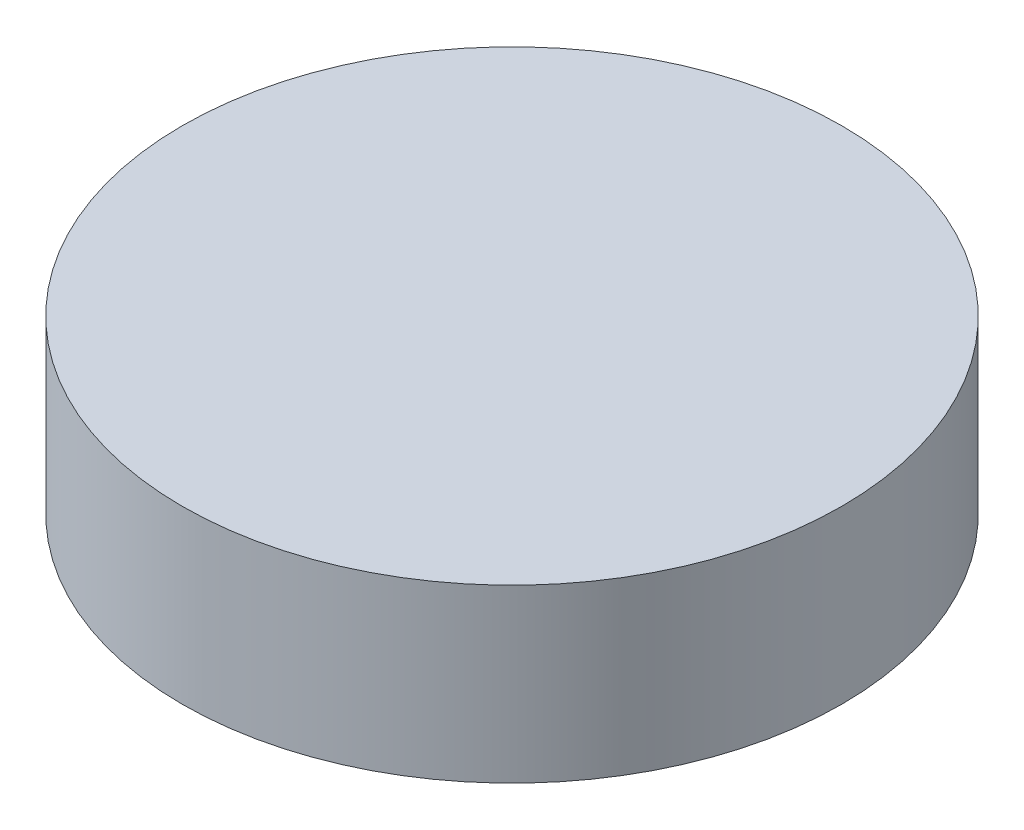
from build123d import *

# Parameters (mm, degrees)
SKETCH1_R           = 7.5
BOSS_EXTRUDE1_DEPTH = 5
SKETCH2_R           = 25
BOSS_EXTRUDE2_DEPTH = 13


with BuildPart() as part:
    # Sketch1 → Boss-Extrude1 (new body)
    with BuildSketch(Plane(origin=(0, 0, 0), x_dir=(1, 0, 0), z_dir=(0, 1, 0))):
        with Locations(Location((0, 0, 0), (0, 0, 270))):
            Circle(SKETCH1_R)
    extrude(amount=BOSS_EXTRUDE1_DEPTH)

    # Sketch2 → Boss-Extrude2 (add)
    with BuildSketch(Plane(origin=(0, 5, 0), x_dir=(1, 0, 0), z_dir=(0, 1, 0))):
        with Locations(Location((0, 0, 0), (0, 0, 90))):
            Circle(SKETCH2_R)
    extrude(amount=BOSS_EXTRUDE2_DEPTH)


solid = part.part
